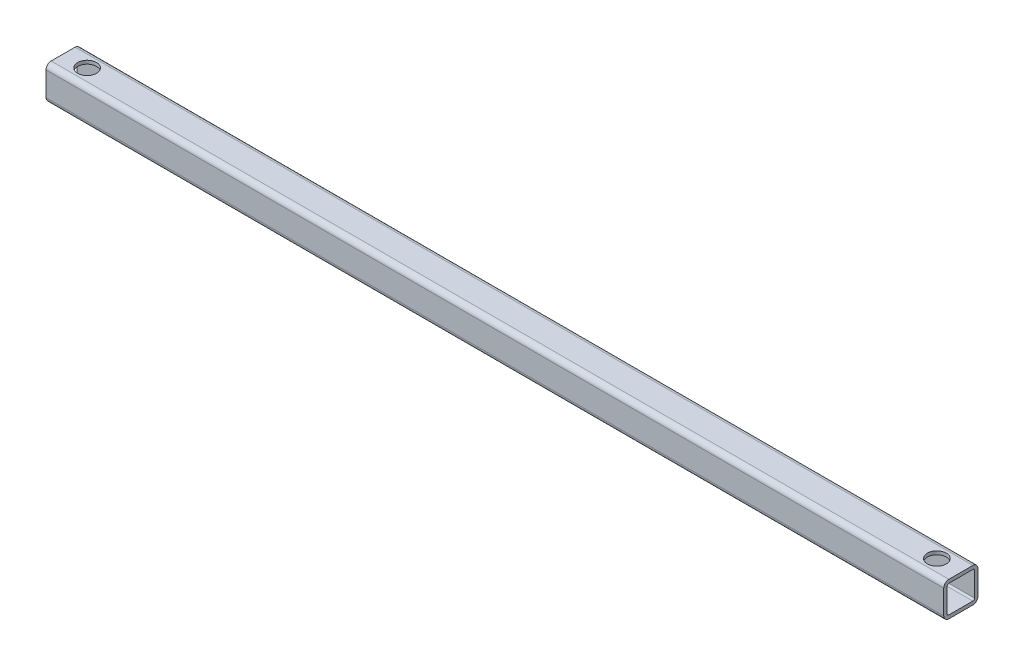
from build123d import *

# Parameters (mm, degrees)
F_20_X_20_X_2_1_DEPTH = 524
CUT_EXTRUDE_1_REACH   = 264.952
SKETCH_3_R            = 5.5
SKETCH_4_R            = 2.5
CUT_EXTRUDE_2_DEPTH   = 263.807914645


with BuildPart() as part:
    # Sketch1 → Квадратная труба 20 X 20 X 2(1) (new body)
    with BuildSketch(Plane.YZ.offset(-262)):
        with BuildLine():
            Line((-7, -10), (7, -10))
            ThreePointArc((7, -10), (9.121320344, -9.121320344), (10, -7))
            Line((10, -7), (10, 7))
            ThreePointArc((10, 7), (9.121320344, 9.121320344), (7, 10))
            Line((7, 10), (-7, 10))
            ThreePointArc((-7, 10), (-9.121320344, 9.121320344), (-10, 7))
            Line((-10, 7), (-10, -7))
            ThreePointArc((-10, -7), (-9.121320344, -9.121320344), (-7, -10))
        make_face()
        with BuildLine():
            Line((-7, -8), (7, -8))
            ThreePointArc((7, -8), (7.707106781, -7.707106781), (8, -7))
            Line((8, -7), (8, 7))
            ThreePointArc((8, 7), (7.707106781, 7.707106781), (7, 8))
            Line((7, 8), (-7, 8))
            ThreePointArc((-7, 8), (-7.707106781, 7.707106781), (-8, 7))
            Line((-8, 7), (-8, -7))
            ThreePointArc((-8, -7), (-7.707106781, -7.707106781), (-7, -8))
        make_face(mode=Mode.SUBTRACT)
    extrude(amount=F_20_X_20_X_2_1_DEPTH)

    # Эскиз3 → Вырез-Вытянуть1 (cut, up to next)
    with BuildSketch(Plane(origin=(0, 10, 0), x_dir=(1, 0, 0), z_dir=(0, 1, 0)), mode=Mode.PRIVATE) as cut_extrude_1_sk1:
        with Locations(Location((-248, 0, 0), (0, 0, 270))):
            Circle(SKETCH_3_R)
    cut_extrude_1_tool1 = extrude(cut_extrude_1_sk1.sketch, amount=-CUT_EXTRUDE_1_REACH, mode=Mode.PRIVATE) & part.part
    # Эскиз3 → Вырез-Вытянуть1 (cut, up to next)
    with BuildSketch(Plane(origin=(0, 10, 0), x_dir=(1, 0, 0), z_dir=(0, 1, 0)), mode=Mode.PRIVATE) as cut_extrude_1_sk2:
        with Locations(Location((248, 0, 0), (0, 0, 270))):
            Circle(SKETCH_3_R)
    cut_extrude_1_tool2 = extrude(cut_extrude_1_sk2.sketch, amount=-CUT_EXTRUDE_1_REACH, mode=Mode.PRIVATE) & part.part
    add(cut_extrude_1_tool1.solids().sort_by_distance((-248, 10, 0))[0], mode=Mode.SUBTRACT)
    add(cut_extrude_1_tool2.solids().sort_by_distance((248, 10, 0))[0], mode=Mode.SUBTRACT)

    # Эскиз4 → Вырез-Вытянуть2 (cut, through all)
    with BuildSketch(Plane(origin=(0, -8, 0), x_dir=(1, 0, 0), z_dir=(0, 1, 0))):
        with Locations(Location((-248, 0, 0), (0, 0, 270))):
            Circle(SKETCH_4_R)
        with Locations(Location((248, 0, 0), (0, 0, 270))):
            Circle(SKETCH_4_R)
    extrude(amount=-CUT_EXTRUDE_2_DEPTH, mode=Mode.SUBTRACT)


solid = part.part
